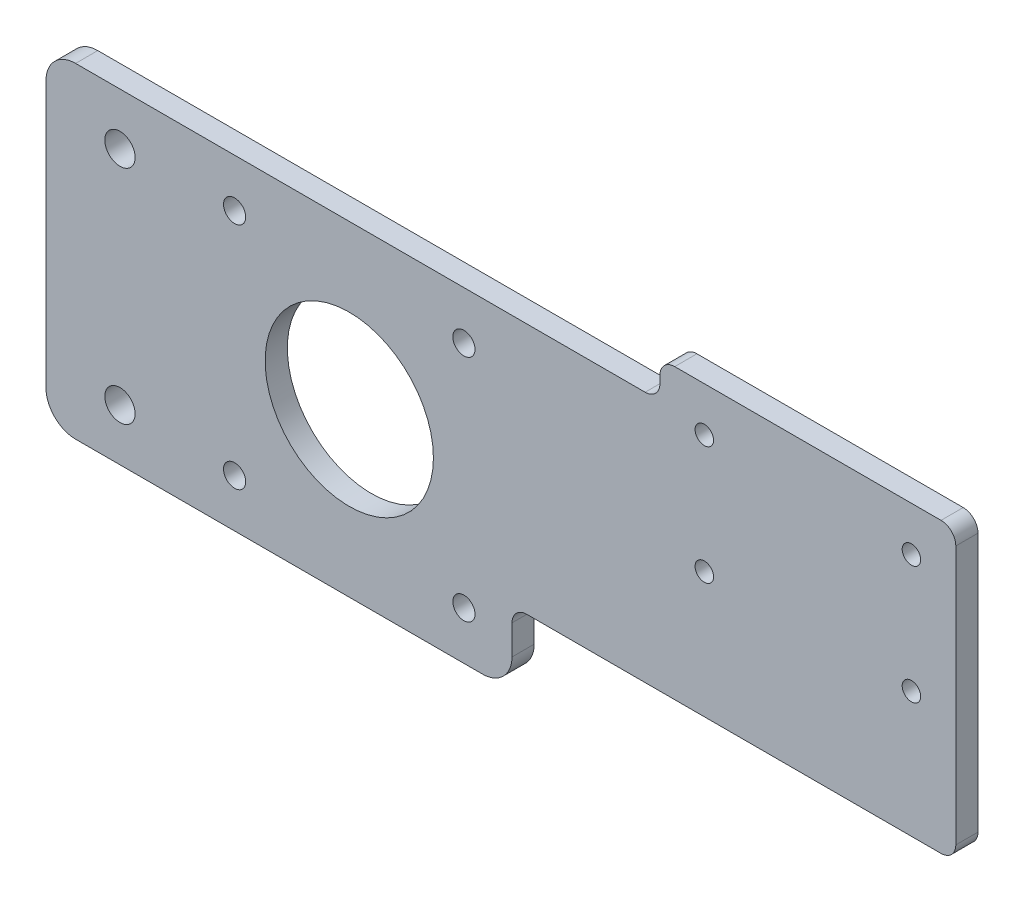
from build123d import *

# Parameters (mm, degrees)
SKETCH1_W                       = 63
SKETCH1_H                       = 44
BOSS_EXTRUDE1_DEPTH             = 1.5
BOSS_EXTRUDE2_DEPTH             = 3
SKETCH2_R                       = 11.375
SKETCH2_R_2                     = 1.5
SKETCH2_R_3                     = 2.05
CUT_EXTRUDE1_DEPTH              = 96.44762962
FILLET1_R                       = 4
TAP_DRILL_FOR_M3X0_5_TAP1_D     = 2.5
TAP_DRILL_FOR_M3X0_5_TAP1_DEPTH = 4
TAP_DRILL_FOR_M3X0_5_TAP1_TIP   = 0.751075774
FILLET2_R                       = 2


with BuildPart() as part:
    # Sketch1 → Boss-Extrude1 (new, symmetric)
    with BuildSketch(Plane.XY):
        Rectangle(SKETCH1_W, SKETCH1_H)
    extrude(amount=BOSS_EXTRUDE1_DEPTH, both=True)

    # Sketch3 → Boss-Extrude2 (add)
    with BuildSketch(Plane.XY.offset(1.5)):
        Polygon((31.5, -12), (91.5, -12), (91.5, 27), (51.5, 27), (51.5, 22), (31.5, 22), align=None)
    extrude(amount=-BOSS_EXTRUDE2_DEPTH)

    # Sketch2 → Cut-Extrude1 (cut, through all)
    with BuildSketch(Plane.XY.offset(1.5)):
        with Locations((9.5, 0)):
            Circle(SKETCH2_R)
        with Locations((-6, 15.5)):
            Circle(SKETCH2_R_2)
        with Locations((25, 15.5)):
            Circle(SKETCH2_R_2)
        with Locations((25, -15.5)):
            Circle(SKETCH2_R_2)
        with Locations((-6, -15.5)):
            Circle(SKETCH2_R_2)
        with Locations((-21.5, 15)):
            Circle(SKETCH2_R_3)
        with Locations((-21.5, -15)):
            Circle(SKETCH2_R_3)
    extrude(amount=-CUT_EXTRUDE1_DEPTH, mode=Mode.SUBTRACT)

    # Fillet1
    fillet1_edges = [part.edges().sort_by_distance(p)[0] for p in [
        (31.5, -22, 0),
        (-31.5, -22, 0),
        (-31.5, 22, 0),
    ]]
    fillet(fillet1_edges, radius=FILLET1_R)

    # Tap Drill for M3x0.5 Tap1
    with Locations(Plane.XY.offset(1.5)):
        with Locations((57.5, 21), (85.5, 21), (85.5, 5), (57.5, 5)):
            Hole(TAP_DRILL_FOR_M3X0_5_TAP1_D / 2, depth=TAP_DRILL_FOR_M3X0_5_TAP1_DEPTH)
            with Locations((0, 0, -(TAP_DRILL_FOR_M3X0_5_TAP1_DEPTH + TAP_DRILL_FOR_M3X0_5_TAP1_TIP / 2))):  # 118° drill point
                Cone(0, TAP_DRILL_FOR_M3X0_5_TAP1_D / 2, TAP_DRILL_FOR_M3X0_5_TAP1_TIP, mode=Mode.SUBTRACT)

    # Fillet2
    fillet2_edges = [part.edges().sort_by_distance(p)[0] for p in [
        (31.5, -12, 0),
        (51.5, 22, 0),
        (51.5, 27, 0),
        (91.5, 27, 0),
        (91.5, -12, 0),
    ]]
    fillet(fillet2_edges, radius=FILLET2_R)


solid = part.part
